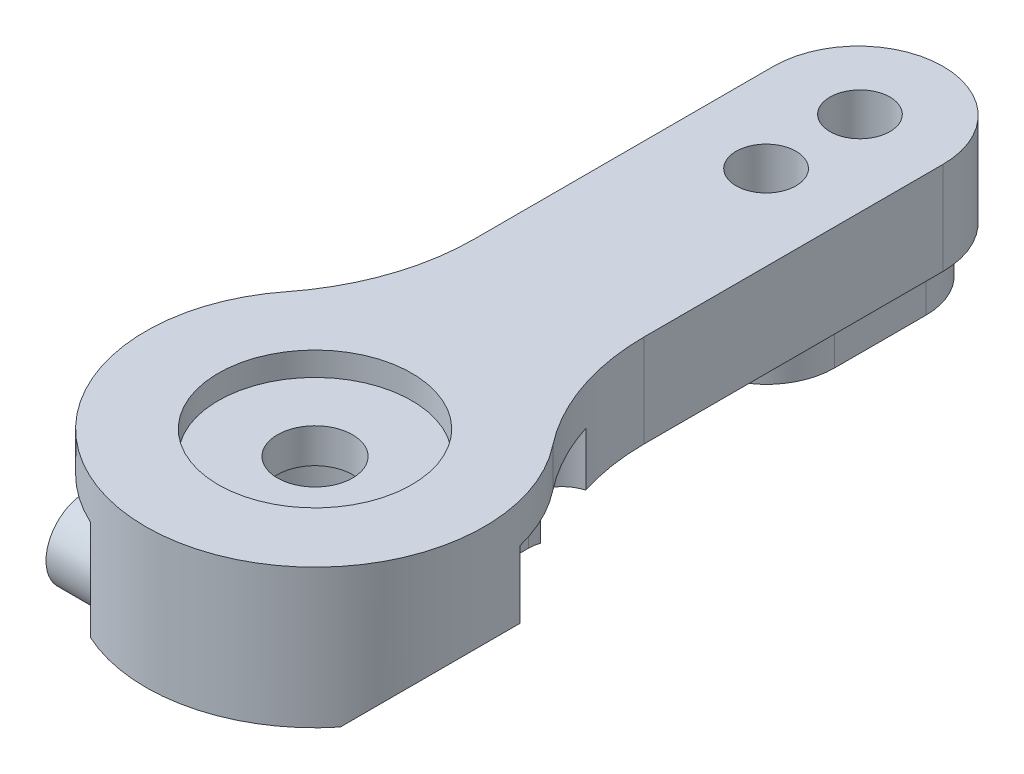
from build123d import *

# Parameters (mm, degrees)
BOSS_EXTRUDE1_DEPTH = 2.05
BOSS_EXTRUDE2_START = 2.05
BOSS_EXTRUDE2_DEPTH = 4.1
FILLET1_R           = 10
SKETCH2_R           = 1.66
CUT_EXTRUDE1_DEPTH  = 30.406512034
SKETCH2_3_R         = 4.275
SKETCH2_3_R_2       = 1.66
CUT_EXTRUDE2_DEPTH  = 1.05
SKETCH3_R           = 1.325
CUT_EXTRUDE3_DEPTH  = 30.406512034
CUT_EXTRUDE4_DEPTH  = 30.406512034
CUT_EXTRUDE5_DEPTH  = 4.42
SKETCH6_R           = 3
CUT_EXTRUDE6_DEPTH  = 3.57
SKETCH7_R           = 1.76
BOSS_EXTRUDE3_DEPTH = 2


with BuildPart() as part:
    # Sketch1 → Boss-Extrude1 (new body)
    with BuildSketch(Plane(origin=(0, 0, 0), x_dir=(1, 0, 0), z_dir=(0, 1, 0))):
        with BuildLine():
            ThreePointArc((7.485, 0), (6.484364849, 3.738748119), (3.75, 6.477864231))
            Line((3.75, 6.477864231), (3.75, 0))
            ThreePointArc((3.75, 0), (0, -3.75), (-3.75, 0))
            Line((-3.75, 0), (-3.75, 6.477864231))
            ThreePointArc((-3.75, 6.477864231), (-3.738748119, -6.484364849), (7.485, 0))
        make_face()
        with BuildLine():
            Line((3.75, 0), (3.75, 6.477864231))
            ThreePointArc((3.75, 6.477864231), (0, 7.485), (-3.75, 6.477864231))
            Line((-3.75, 6.477864231), (-3.75, 0))
            ThreePointArc((-3.75, 0), (0, -3.75), (3.75, 0))
        make_face()
        with BuildLine():
            Line((-3, 24.015), (-3, 19.955))
            ThreePointArc((-3, 19.955), (0, 16.955), (3, 19.955))
            Line((3, 19.955), (3, 24.015))
            ThreePointArc((3, 24.015), (0, 27.015), (-3, 24.015))
        make_face()
    extrude(amount=BOSS_EXTRUDE1_DEPTH)

    # Sketch1<3> → Boss-Extrude2 (add)
    # profile 1 of 6: a face of its own
    with BuildSketch(Plane(origin=(0, 0, 0), x_dir=(1, 0, 0), z_dir=(0, 1, 0)).offset(BOSS_EXTRUDE2_START)):
        with BuildLine():
            ThreePointArc((7.485, 0), (6.484364849, 3.738748119), (3.75, 6.477864231))
            Line((3.75, 6.477864231), (3.75, 0))
            ThreePointArc((3.75, 0), (0, -3.75), (-3.75, 0))
            Line((-3.75, 0), (-3.75, 6.477864231))
            ThreePointArc((-3.75, 6.477864231), (-3.738748119, -6.484364849), (7.485, 0))
        make_face()
    # profile 2 of 6: a face of its own
    with BuildSketch(Plane(origin=(0, 0, 0), x_dir=(1, 0, 0), z_dir=(0, 1, 0)).offset(BOSS_EXTRUDE2_START)):
        with BuildLine():
            Line((3.75, 0), (3.75, 6.477864231))
            ThreePointArc((3.75, 6.477864231), (0, 7.485), (-3.75, 6.477864231))
            Line((-3.75, 6.477864231), (-3.75, 0))
            ThreePointArc((-3.75, 0), (0, -3.75), (3.75, 0))
        make_face()
    # profile 3 of 6: a face of its own
    with BuildSketch(Plane(origin=(0, 0, 0), x_dir=(1, 0, 0), z_dir=(0, 1, 0)).offset(BOSS_EXTRUDE2_START)):
        with BuildLine():
            ThreePointArc((7.485, 0), (6.484364849, 3.738748119), (3.75, 6.477864231))
            Line((3.75, 6.477864231), (3.75, 0))
            ThreePointArc((3.75, 0), (0, -3.75), (-3.75, 0))
            Line((-3.75, 0), (-3.75, 6.477864231))
            ThreePointArc((-3.75, 6.477864231), (-3.738748119, -6.484364849), (7.485, 0))
        make_face()
    # profile 4 of 6: a face of its own
    with BuildSketch(Plane(origin=(0, 0, 0), x_dir=(1, 0, 0), z_dir=(0, 1, 0)).offset(BOSS_EXTRUDE2_START)):
        with BuildLine():
            Line((3.75, 0), (3.75, 6.477864231))
            ThreePointArc((3.75, 6.477864231), (0, 7.485), (-3.75, 6.477864231))
            Line((-3.75, 6.477864231), (-3.75, 0))
            ThreePointArc((-3.75, 0), (0, -3.75), (3.75, 0))
        make_face()
    # profile 5 of 6: a face of its own
    with BuildSketch(Plane(origin=(0, 0, 0), x_dir=(1, 0, 0), z_dir=(0, 1, 0)).offset(BOSS_EXTRUDE2_START)):
        with BuildLine():
            Line((3.75, 6.477864231), (3.75, 24.015))
            ThreePointArc((3.75, 24.015), (0, 27.765), (-3.75, 24.015))
            Line((-3.75, 24.015), (-3.75, 6.477864231))
            ThreePointArc((-3.75, 6.477864231), (0, 7.485), (3.75, 6.477864231))
        make_face()
        with BuildLine():
            ThreePointArc((-3, 24.015), (0, 27.015), (3, 24.015))
            Line((3, 24.015), (3, 19.955))
            ThreePointArc((3, 19.955), (0, 16.955), (-3, 19.955))
            Line((-3, 19.955), (-3, 24.015))
        make_face(mode=Mode.SUBTRACT)
    # profile 6 of 6: a face of its own
    with BuildSketch(Plane(origin=(0, 0, 0), x_dir=(1, 0, 0), z_dir=(0, 1, 0)).offset(BOSS_EXTRUDE2_START)):
        with BuildLine():
            Line((-3, 24.015), (-3, 19.955))
            ThreePointArc((-3, 19.955), (0, 16.955), (3, 19.955))
            Line((3, 19.955), (3, 24.015))
            ThreePointArc((3, 24.015), (0, 27.015), (-3, 24.015))
        make_face()
    extrude(amount=BOSS_EXTRUDE2_DEPTH)

    # Fillet1
    fillet1_edges = [part.edges().sort_by_distance(p)[0] for p in [
        (-3.75, 4.1, -6.477864231),
        (3.75, 4.1, -6.477864231),
    ]]
    fillet(fillet1_edges, radius=FILLET1_R)

    # Sketch2 → Cut-Extrude1 (cut, through all)
    with BuildSketch(Plane(origin=(0, 6.15, 0), x_dir=(1, 0, 0), z_dir=(0, 1, 0))):
        with Locations(Location((0, 0, 0), (0, 0, 270))):
            Circle(SKETCH2_R)
    extrude(amount=-CUT_EXTRUDE1_DEPTH, mode=Mode.SUBTRACT)

    # Sketch2<3> → Cut-Extrude2 (cut)
    with BuildSketch(Plane(origin=(0, 6.15, 0), x_dir=(1, 0, 0), z_dir=(0, 1, 0))):
        with Locations(Location((0, 0, 0), (0, 0, 270))):
            Circle(SKETCH2_3_R)
        with Locations(Location((0, 0, 0), (0, 0, 270))):
            Circle(SKETCH2_3_R_2, mode=Mode.SUBTRACT)
    extrude(amount=-CUT_EXTRUDE2_DEPTH, mode=Mode.SUBTRACT)

    # Sketch3 → Cut-Extrude3 (cut, through all)
    with BuildSketch(Plane(origin=(0, 0, 0), x_dir=(-1, 0, 0), z_dir=(0, -1, 0))):
        with Locations(Location((0, 19.94, 0), (0, 0, 90))):
            Circle(SKETCH3_R)
        with Locations(Location((0, 24.09, 0), (0, 0, 90))):
            Circle(SKETCH3_R)
    extrude(amount=-CUT_EXTRUDE3_DEPTH, mode=Mode.SUBTRACT)

    # Sketch4 → Cut-Extrude4 (cut, symmetric)
    with BuildSketch(Plane.XY):
        Polygon((-23.349611589, -29.172910653), (5.823299064, 0), (7.485, 1.661700936), (36.657910653, 30.834611589), (95.003731959, -27.511209717), (34.996209717, -87.518731959), align=None)
    cut_extrude4 = extrude(amount=CUT_EXTRUDE4_DEPTH, both=True, mode=Mode.SUBTRACT)

    # Mirror1: Cut-Extrude4 across plane
    add(cut_extrude4.mirror(Plane(origin=(0, 0, 0), x_dir=(0, 0, 1), z_dir=(1, 0, 0))), mode=Mode.SUBTRACT)

    # Sketch5 → Cut-Extrude5 (cut)
    with BuildSketch(Plane.XZ):
        with BuildLine():
            Line((21.72046725, -1.797403589), (4.635, -1.797403589))
            ThreePointArc((4.635, -1.797403589), (3.574339828, -2.236743417), (3.135, -3.297403589))
            Line((3.135, -3.297403589), (3.135, -6.297403589))
            ThreePointArc((3.135, -6.297403589), (3.574339828, -7.35806376), (4.635, -7.797403589))
            Line((4.635, -7.797403589), (21.72046725, -7.797403589))
            Line((21.72046725, -7.797403589), (21.72046725, -1.797403589))
        make_face()
        with BuildLine():
            Line((-4.635, 1.797403589), (-13.906337827, 1.797403589))
            Line((-13.906337827, 1.797403589), (-13.906337827, 10.507844077))
            Line((-13.906337827, 10.507844077), (-3.135, 10.507844077))
            Line((-3.135, 10.507844077), (-3.135, 3.297403589))
            ThreePointArc((-3.135, 3.297403589), (-3.574339828, 2.236743417), (-4.635, 1.797403589))
        make_face()
    extrude(amount=-CUT_EXTRUDE5_DEPTH, mode=Mode.SUBTRACT)

    # Sketch6 → Cut-Extrude6 (cut)
    with BuildSketch(Plane.XZ):
        with Locations(Location((0, 0, 0), (0, 0, 270))):
            Circle(SKETCH6_R)
    extrude(amount=-CUT_EXTRUDE6_DEPTH, mode=Mode.SUBTRACT)

    # Sketch7 → Boss-Extrude3 (add)
    with BuildSketch(Plane.ZY.offset(3.135)):
        with Locations(Location((4.997403589, 1.92, 0), (0, 0, 164.996295671))):
            Circle(SKETCH7_R)
    extrude(amount=BOSS_EXTRUDE3_DEPTH)


solid = part.part
